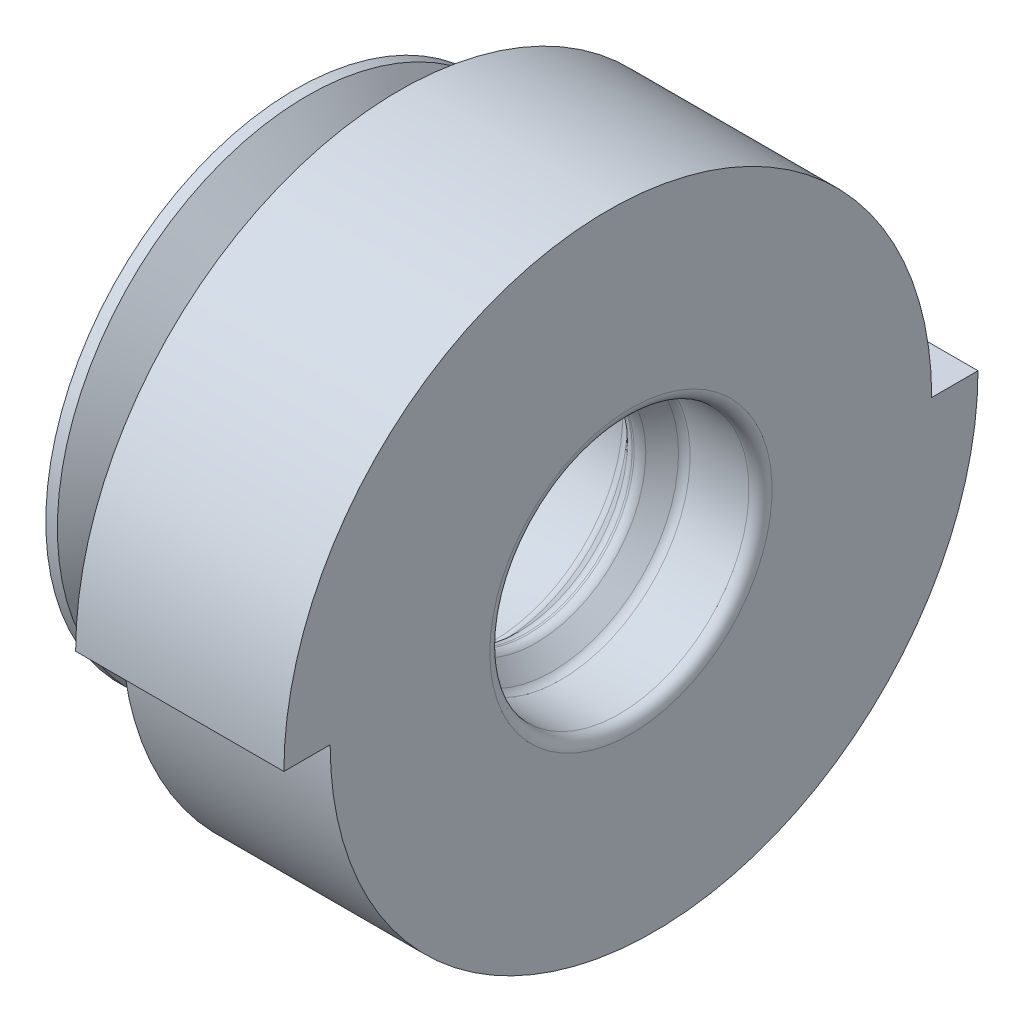
from build123d import *

# Parameters (mm, degrees)
SKETCH1_R           = 11.2
BOSS_EXTRUDE1_DEPTH = 18
FILLET1_R           = 1


with BuildPart() as part:
    # Sketch1 → Boss-Extrude1 (new body)
    with BuildSketch(Plane(origin=(0, 0, 0), x_dir=(0, 0, -1), z_dir=(1, 0, 0))):
        with BuildLine():
            Line((26, 0), (30, 0))
            ThreePointArc((30, 0), (2, -28), (-26, 0))
            Line((-26, 0), (-30, 0))
            ThreePointArc((-30, 0), (-2, 28), (26, 0))
        make_face()
        Circle(SKETCH1_R, mode=Mode.SUBTRACT)
    extrude(amount=BOSS_EXTRUDE1_DEPTH)

    # Sketch2 → Revolve1 (revolve)
    with BuildSketch(Plane(origin=(0, 0, 0), x_dir=(1, 0, 0), z_dir=(0, 1, 0))):
        Polygon((0, 21.579383981), (-1, 21.579383981), (-1, 18.6), (-7.5, 18.6), (-10, 21.579383981), (-11, 21.579383981), (-11, 17.579383981), (0, 11.2), align=None)
    revolve(axis=Axis((0, 0, 0), (-1, 0, 0)))

    # Sketch4 → Revolve2 (revolve)
    with BuildSketch(Plane.XY, mode=Mode.PRIVATE) as revolve2_sk:
        Polygon((6.5, 11.2), (8.5, 9.2), (9.5, 9.2), (11.5, 11.2), align=None)
    revolve(revolve2_sk.sketch.rotate(Axis((0, 0, 0), (1, 0, 0)), 90), axis=Axis((0, 0, 0), (1, 0, 0)))

    # Fillet1
    fillet1_edges = [part.edges().sort_by_distance(p)[0] for p in [
        (0, 0, 11.2),
        (18, 0, 11.2),
        (-11, 0, 17.579383981),
        (11.5, 11.2, 0),
        (6.5, 11.2, 0),
        (8.5, 0, -9.2),
        (9.5, 0, -9.2),
    ]]
    fillet(fillet1_edges, radius=FILLET1_R)


solid = part.part
